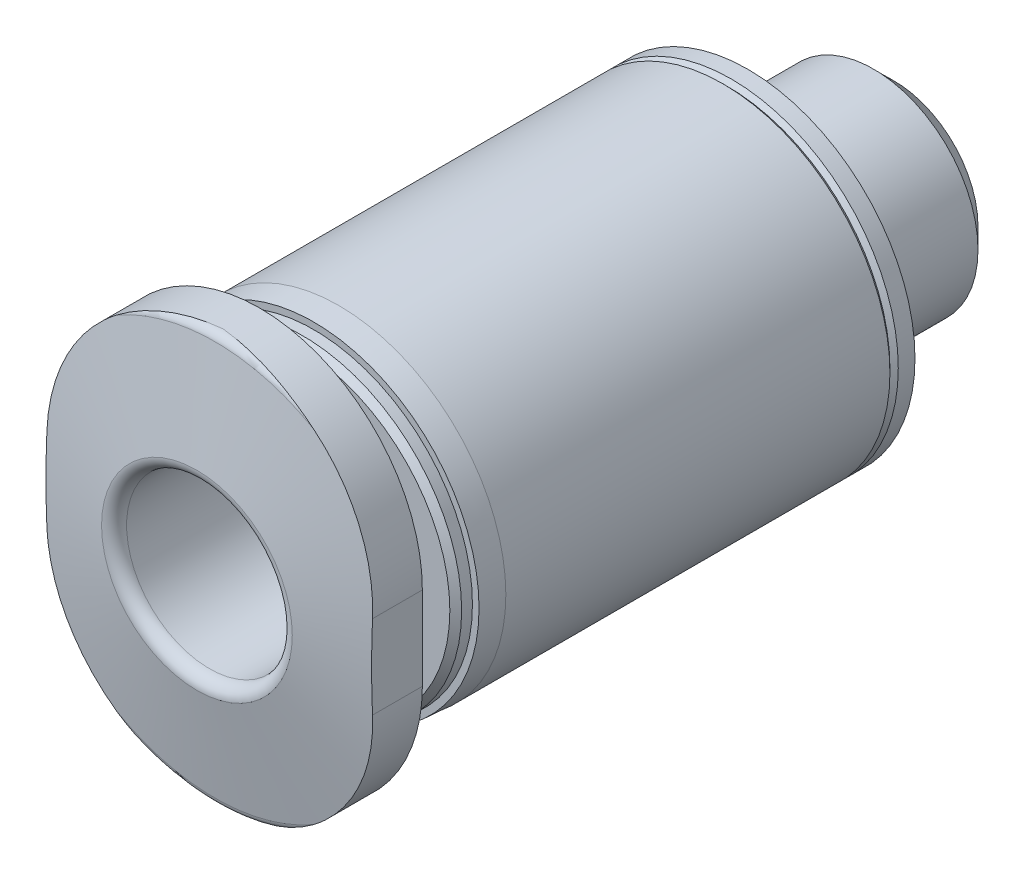
from build123d import *

# Parameters (mm, degrees)
SKETCH2_W          = 19.6
SKETCH2_H          = 19.6
CUT_EXTRUDE1_DEPTH = 1.5
CUT_EXTRUDE2_DEPTH = 5.2


with BuildPart() as part:
    # Sketch1 → Revolve1 (revolve)
    with BuildSketch(Plane(origin=(0, 0, 0), x_dir=(0, 0, -1), z_dir=(1, 0, 0)), mode=Mode.PRIVATE) as revolve1_sk:
        with BuildLine():
            Line((-13.2, 0), (-13.2, 2.2845))
            Line((-13.2, 2.2845), (-12.767958406, 4.734729636))
            ThreePointArc((-12.767958406, 4.734729636), (-12.699554378, 4.853208889), (-12.570996856, 4.9))
            Line((-12.570996856, 4.9), (-11.7, 4.9))
            Line((-11.7, 4.9), (-11.7, 3.0595))
            ThreePointArc((-11.7, 3.0595), (-11.590165043, 2.794334957), (-11.325, 2.6845))
            Line((-11.325, 2.6845), (-10.8, 2.6845))
            Line((-10.8, 2.6845), (-10.8, 3.658578644))
            Line((-10.8, 3.658578644), (-10.658578644, 3.8))
            Line((-10.658578644, 3.8), (-10.4, 3.8))
            Line((-10.4, 3.8), (-10.4, 3.958043913))
            Line((-10.4, 3.958043913), (-9.8, 4))
            Line((-9.8, 4), (-0.6, 4))
            Line((-0.6, 4), (-0.5, 3.9))
            Line((-0.5, 3.9), (-0.4, 4))
            Line((-0.4, 4), (0, 4))
            Line((0, 4), (0, 2.5))
            Line((0, 2.5), (3.0095, 2.5))
            Line((3.0095, 2.5), (3.5, 2.0095))
            Line((3.5, 2.0095), (3.5, 0))
            Line((3.5, 0), (-13.2, 0))
        make_face()
    revolve(revolve1_sk.sketch.rotate(Axis((0, 0, -3.5), (0, 0, 1)), 270), axis=Axis((0, 0, -3.5), (0, 0, 1)))

    # Sketch2 → Cut-Extrude1 (cut)
    with BuildSketch(Plane.XY.offset(13.2)):
        Rectangle(SKETCH2_W, SKETCH2_H)
        with BuildLine():
            Line((-3.9, 1), (-3.9, -1))
            ThreePointArc((-3.9, -1), (0, -4.9), (3.9, -1))
            Line((3.9, -1), (3.9, 1))
            ThreePointArc((3.9, 1), (0, 4.9), (-3.9, 1))
        make_face(mode=Mode.SUBTRACT)
    extrude(amount=-CUT_EXTRUDE1_DEPTH, mode=Mode.SUBTRACT)

    # Sketch3 → Cut-Extrude2 (cut)
    with BuildSketch(Plane.XY.offset(-3.5)):
        Polygon((-1.25, -0.721687836), (0, -1.443375673), (1.25, -0.721687836), (1.25, 0.721687836), (0, 1.443375673), (-1.25, 0.721687836), align=None)
    extrude(amount=CUT_EXTRUDE2_DEPTH, mode=Mode.SUBTRACT)

    # Sketch4 → Cut-Revolve1 (revolve, cut)
    with BuildSketch(Plane(origin=(0, 0, 0), x_dir=(0, 0, -1), z_dir=(1, 0, 0)), mode=Mode.PRIVATE) as cut_revolve1_sk:
        with BuildLine():
            Line((-13.2, 0), (-13.2, 2.2845))
            ThreePointArc((-13.2, 2.2845), (-13.112132034, 2.072367966), (-12.9, 1.9845))
            Line((-12.9, 1.9845), (-1.7, 1.9845))
            Line((-1.7, 1.9845), (-1.7, 0))
            Line((-1.7, 0), (-13.2, 0))
        make_face()
    revolve(cut_revolve1_sk.sketch.rotate(Axis((0, 0, 1.7), (0, 0, 1)), 270), axis=Axis((0, 0, 1.7), (0, 0, 1)), mode=Mode.SUBTRACT)


solid = part.part
